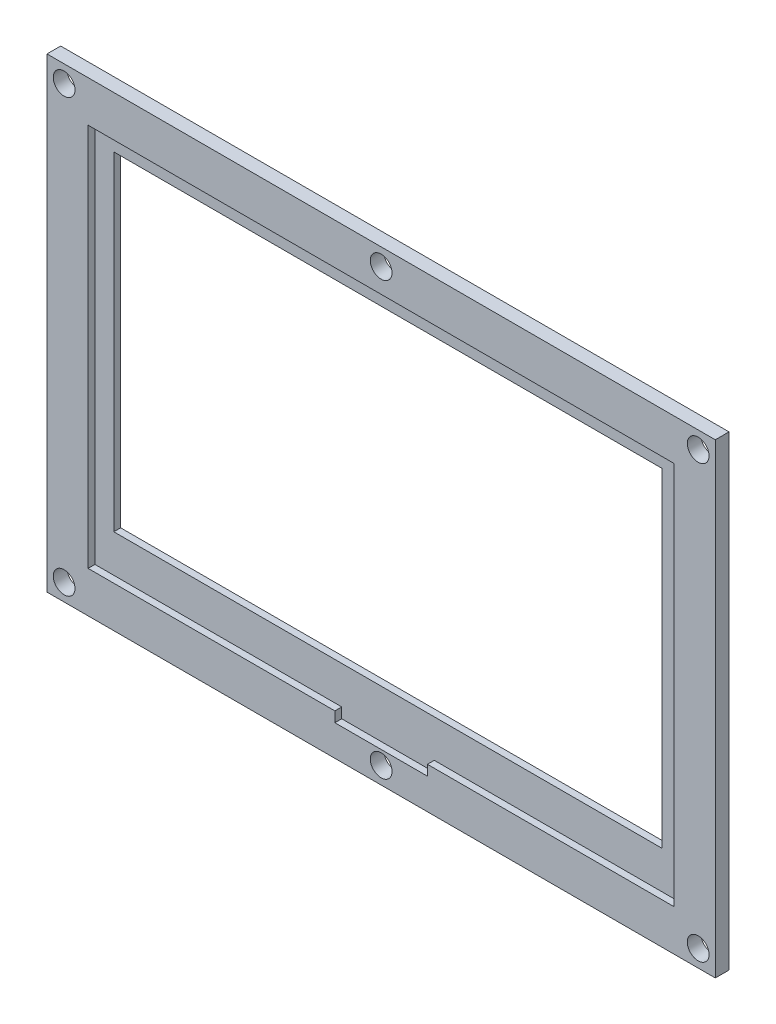
from build123d import *

# Parameters (mm, degrees)
SKETCH1_W           = 195
SKETCH1_H           = 136
SKETCH1_W_2         = 160
SKETCH1_H_2         = 96
BOSS_EXTRUDE1_DEPTH = 2
SKETCH1_3_W         = 195
SKETCH1_3_H         = 136
BOSS_EXTRUDE2_DEPTH = 2
SKETCH2_R           = 3.175
CUT_EXTRUDE1_DEPTH  = 119.938009064


with BuildPart() as part:
    # Sketch1 → Boss-Extrude1 (new body)
    with BuildSketch(Plane.XY):
        Rectangle(SKETCH1_W, SKETCH1_H)
        with Locations((0, 3)):
            Rectangle(SKETCH1_W_2, SKETCH1_H_2, mode=Mode.SUBTRACT)
    extrude(amount=-BOSS_EXTRUDE1_DEPTH)

    # Sketch1<3> → Boss-Extrude2 (add)
    with BuildSketch(Plane.XY):
        Rectangle(SKETCH1_3_W, SKETCH1_3_H)
        Polygon((85.5, 56), (85.5, -56), (13.5, -56), (13.5, -59), (-13.5, -59), (-13.5, -56), (-85.5, -56), (-85.5, 56), align=None, mode=Mode.SUBTRACT)
    extrude(amount=BOSS_EXTRUDE2_DEPTH)

    # Sketch2 → Cut-Extrude1 (cut, through all)
    with BuildSketch(Plane.XY.offset(2)):
        with Locations((-92.5, 63)):
            Circle(SKETCH2_R)
        with Locations((0, 63)):
            Circle(SKETCH2_R)
        with Locations((92.5, 63)):
            Circle(SKETCH2_R)
        with Locations((92.5, -63)):
            Circle(SKETCH2_R)
        with Locations((0, -63)):
            Circle(SKETCH2_R)
        with Locations((-92.5, -63)):
            Circle(SKETCH2_R)
    extrude(amount=-CUT_EXTRUDE1_DEPTH, mode=Mode.SUBTRACT)


solid = part.part
